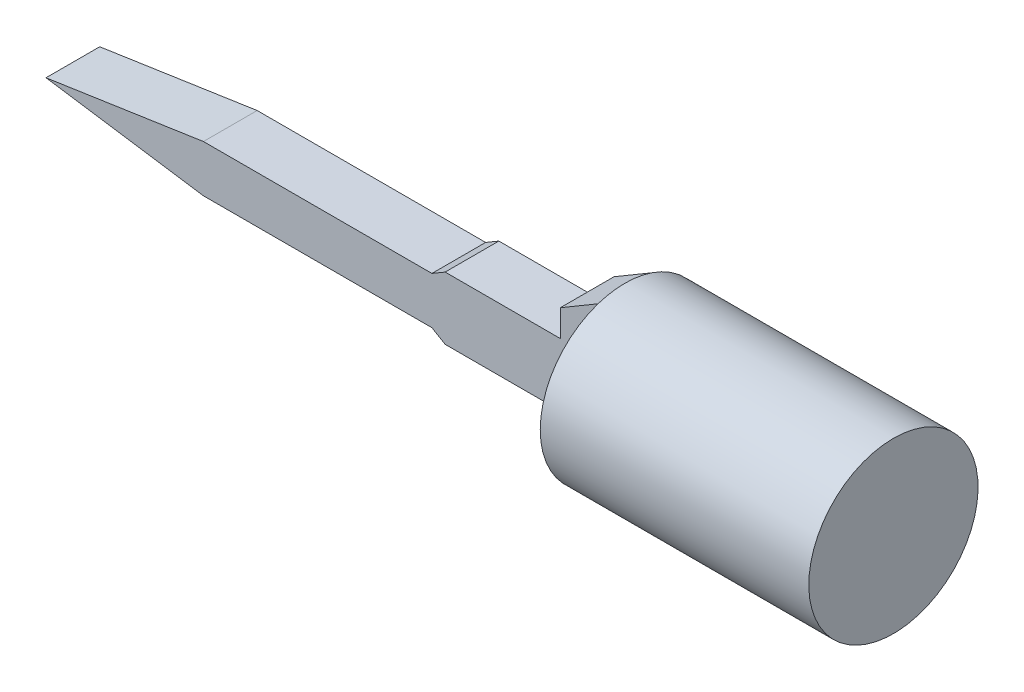
from build123d import *

# Parameters (mm, degrees)
BOSS_EXTRUDE7_DEPTH = 20
SKETCH12_R          = 31.514643475
BOSS_EXTRUDE8_DEPTH = 100


with BuildPart() as part:
    # Sketch1 → Boss-Extrude7 (new body)
    with BuildSketch(Plane.XY):
        Polygon((-74.036406968, -41.544157833), (-74.036406968, -29.88599594), (-265.556443783, -29.88599594), (-206.925428257, -38.639637749), (-121.846026988, -38.639637749), (-116.925428257, -41.544157833), align=None)
        Polygon((-74.036406968, -29.88599594), (-74.036406968, -18.227834048), (-116.925428257, -18.227834048), (-121.846026988, -21.132354132), (-206.925428257, -21.132354132), (-265.556443783, -29.88599594), align=None)
        Polygon((-60, -59.771991881), (-60, -29.88599594), (-74.036406968, -29.88599594), (-74.036406968, -41.544157833), (-74.036406968, -51.486612768), align=None)
        Polygon((-60, -29.88599594), (-60, 0), (-74.036406968, -8.285379113), (-74.036406968, -18.227834048), (-74.036406968, -29.88599594), align=None)
    extrude(amount=BOSS_EXTRUDE7_DEPTH)

    # Sketch12 → Boss-Extrude8 (add)
    with BuildSketch(Plane(origin=(-60, 0, 0), x_dir=(0, 0, -1), z_dir=(1, 0, 0))):
        with Locations(Location((-10, -29.88599594, 0), (0, 0, 251.499507524))):
            Circle(SKETCH12_R)
    extrude(amount=BOSS_EXTRUDE8_DEPTH)


solid = part.part
